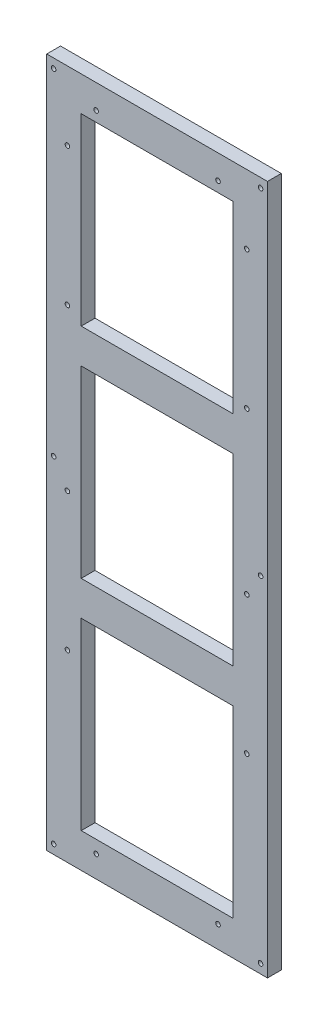
from build123d import *

# Parameters (mm, degrees)
SKETCH1_W           = 96
SKETCH1_H           = 300
SKETCH1_W_2         = 66
SKETCH1_H_2         = 80
BOSS_EXTRUDE1_DEPTH = 6
SKETCH3_R           = 1
CUT_EXTRUDE6_DEPTH  = 10
SKETCH5_R           = 1
CUT_EXTRUDE9_DEPTH  = 10
SKETCH7_R           = 1
CUT_EXTRUDE10_DEPTH = 10


with BuildPart() as part:
    # Sketch1 → Boss-Extrude1 (new body)
    with BuildSketch(Plane.XY):
        with Locations((0, 6)):
            Rectangle(SKETCH1_W, SKETCH1_H)
        with Locations((0, 101)):
            Rectangle(SKETCH1_W_2, SKETCH1_H_2, mode=Mode.SUBTRACT)
        with Locations((0, -89)):
            Rectangle(SKETCH1_W_2, SKETCH1_H_2, mode=Mode.SUBTRACT)
        with Locations((0, 6)):
            Rectangle(SKETCH1_W_2, SKETCH1_H_2, mode=Mode.SUBTRACT)
    extrude(amount=BOSS_EXTRUDE1_DEPTH)

    # Sketch3 → Cut-Extrude6 (cut)
    with BuildSketch(Plane.XY.offset(6)):
        with Locations((-39, 126)):
            Circle(SKETCH3_R)
        with Locations((-39, -4)):
            Circle(SKETCH3_R)
        with Locations((-39, 66)):
            Circle(SKETCH3_R)
        with Locations((-39, -64)):
            Circle(SKETCH3_R)
        with Locations(Location((39, -64, 0), (0, 0, 180))):
            Circle(SKETCH3_R)
        with Locations(Location((39, -4, 0), (0, 0, 180))):
            Circle(SKETCH3_R)
        with Locations(Location((39, 66, 0), (0, 0, 180))):
            Circle(SKETCH3_R)
        with Locations(Location((39, 126, 0), (0, 0, 180))):
            Circle(SKETCH3_R)
    extrude(amount=-CUT_EXTRUDE6_DEPTH, mode=Mode.SUBTRACT)

    # Sketch5 → Cut-Extrude9 (cut)
    with BuildSketch(Plane.XY.offset(6)):
        with Locations((-26.5, -134.5)):
            Circle(SKETCH5_R)
        with Locations((26.5, -134.5)):
            Circle(SKETCH5_R)
        with Locations((-26.5, 145.5)):
            Circle(SKETCH5_R)
        with Locations((26.5, 145.5)):
            Circle(SKETCH5_R)
    extrude(amount=-CUT_EXTRUDE9_DEPTH, mode=Mode.SUBTRACT)

    # Sketch7 → Cut-Extrude10 (cut)
    with BuildSketch(Plane.XY.offset(6)):
        with Locations((45, -140)):
            Circle(SKETCH7_R)
        with Locations((-45, -140)):
            Circle(SKETCH7_R)
        with Locations((45, 152)):
            Circle(SKETCH7_R)
        with Locations((-45, 152)):
            Circle(SKETCH7_R)
        with Locations((45, 6)):
            Circle(SKETCH7_R)
        with Locations((-45, 6)):
            Circle(SKETCH7_R)
    extrude(amount=-CUT_EXTRUDE10_DEPTH, mode=Mode.SUBTRACT)


solid = part.part
